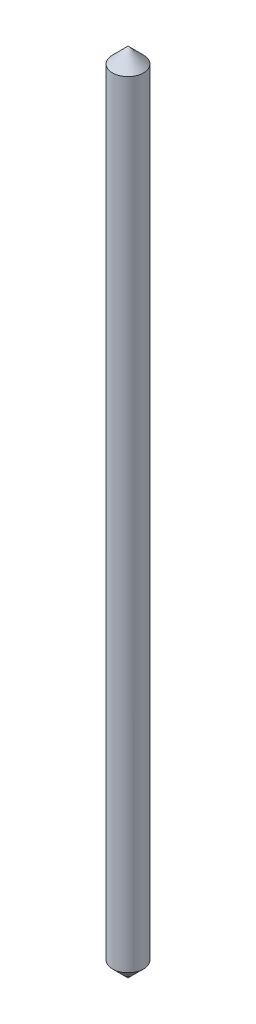
from build123d import *

# Parameters (mm, degrees)
CROQUIS1_R              = 5
SALIENTE_EXTRUIR1_DEPTH = 250


with BuildPart() as part:
    # Croquis1 → Saliente-Extruir1 (new body)
    with BuildSketch(Plane(origin=(0, 0, 0), x_dir=(1, 0, 0), z_dir=(0, 1, 0))):
        Circle(CROQUIS1_R)
    extrude(amount=SALIENTE_EXTRUIR1_DEPTH)

    # Saliente-Extruir2 cone 1 section (through the dimple's axis) → Saliente-Extruir2 (revolve)
    with BuildSketch(Plane(origin=(0, 250, 0), x_dir=(0, 0, -1), z_dir=(1, 0, 0))):
        Polygon((0, 0), (5, 0), (0, 5), align=None)
    revolve(axis=Axis((0, 250, 0), (0, 1, 0)))

    # Saliente-Extruir3 cone 1 section (through the dimple's axis) → Saliente-Extruir3 (revolve)
    with BuildSketch(Plane(origin=(0, 0, 0), x_dir=(0, 0, 1), z_dir=(1, 0, 0))):
        Polygon((0, 0), (5, 0), (0, 5), align=None)
    revolve(axis=Axis((0, 0, 0), (0, -1, 0)))


solid = part.part
